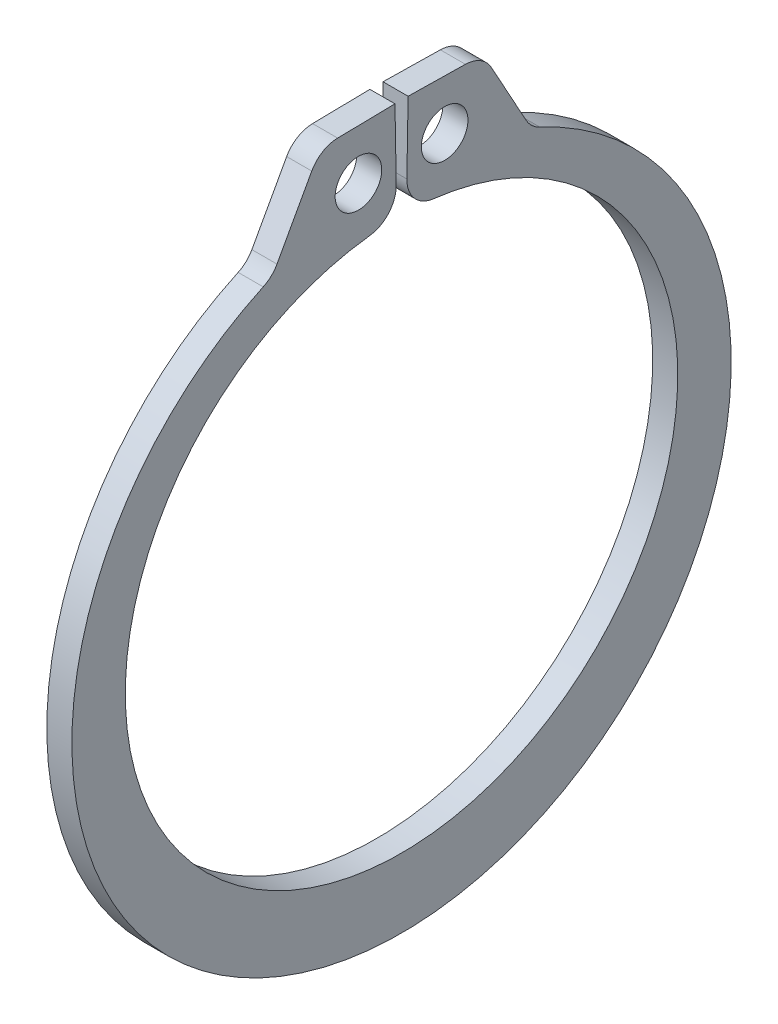
from build123d import *

# Parameters (mm, degrees)
BOSS_EXTRUDE1_DEPTH      = 0.5334
BOSS_EXTRUDE1_DEPTH_BACK = 0.5334
SKETCH3_R                = 0.9906
FILLET1_R                = 1.2827


with BuildPart() as part:
    # Sketch3 → Boss-Extrude1 (new, two sides: drawn at the far end of the back side and taken through both)
    with BuildSketch(Plane(origin=(0, 0, 0), x_dir=(0, 0, -1), z_dir=(1, 0, 0)).offset(-BOSS_EXTRUDE1_DEPTH_BACK)):
        with BuildLine():
            Line((-3.459917227, 15.931342539), (-5.505255869, 12.215234753))
            ThreePointArc((-5.505255869, 12.215234753), (0, -14.6939), (5.505255869, 12.215234753))
            Line((5.505255869, 12.215234753), (3.459917227, 15.931342539))
            Line((3.459917227, 15.931342539), (0.279051762, 15.986864752))
            Line((0.279051762, 15.986864752), (0.205022145, 11.745710799))
            ThreePointArc((0.205022145, 11.745710799), (0, -11.7475), (-0.205022145, 11.745710799))
            Line((-0.205022145, 11.745710799), (-0.279051762, 15.986864752))
            Line((-0.279051762, 15.986864752), (-3.459917227, 15.931342539))
        make_face()
        with Locations((-1.832469686, 13.838526669)):
            Circle(SKETCH3_R, mode=Mode.SUBTRACT)
        with Locations((1.832469686, 13.838526669)):
            Circle(SKETCH3_R, mode=Mode.SUBTRACT)
    extrude(amount=BOSS_EXTRUDE1_DEPTH + BOSS_EXTRUDE1_DEPTH_BACK)

    # Fillet1
    fillet1_edges = [part.edges().sort_by_distance(p)[0] for p in [
        (0, 12.215234753, 5.505255869),
        (0, 15.931342539, 3.459917227),
        (0, 11.745710799, 0.205022145),
        (0, 11.745710799, -0.205022145),
        (0, 15.931342539, -3.459917227),
        (0, 12.215234753, -5.505255869),
    ]]
    fillet(fillet1_edges, radius=FILLET1_R)


solid = part.part
